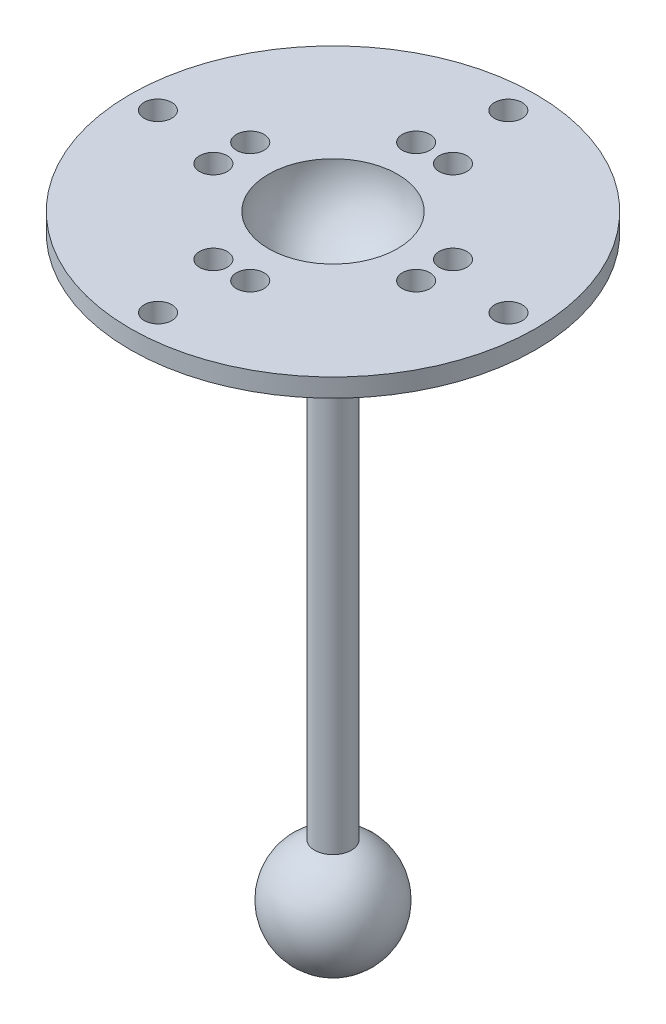
from build123d import *

# Parameters (mm, degrees)
SKETCH2_R          = 0.75
SKETCH2_R_2        = 0.5
CUT_EXTRUDE1_DEPTH = 40


with BuildPart() as part:
    # Sketch1 → Revolve1 (revolve)
    with BuildSketch(Plane(origin=(0, 0, 0), x_dir=(0, 0, -1), z_dir=(1, 0, 0))):
        with BuildLine():
            ThreePointArc((-3.5, 4), (-2.474873734, 1.525126266), (0, 0.5))
            Line((0, 0.5), (0, 0))
            Line((0, 0), (0, -25.34))
            Line((0, -25.34), (0, -31.34))
            ThreePointArc((0, -31.34), (-2.956795679, -28.847305936), (-1, -25.511572875))
            Line((-1, -25.511572875), (-1, 0.127016654))
            ThreePointArc((-1, 0.127016654), (-2.457034335, 0.843580783), (-3.50920881, 2.080246493))
            Line((-3.50920881, 2.080246493), (-11, 3))
            Line((-11, 3), (-11, 4))
            Line((-11, 4), (-4, 4))
            Line((-4, 4), (-3.5, 4))
        make_face()
    revolve(axis=Axis((0, 10.634252877, 0), (0, 1, 0)))

    # Sketch2 → Cut-Extrude1 (cut)
    with BuildSketch(Plane(origin=(0, 4, 0), x_dir=(1, 0, 0), z_dir=(0, 1, 0))):
        with Locations(Location((-5.489872585, -1, 0), (0, 0, 270))):
            Circle(SKETCH2_R)
        with Locations(Location((-9.5, 0, 0), (0, 0, 270))):
            Circle(SKETCH2_R)
        with Locations(Location((0.00965171, -9.5, 0), (0, 0, 270))):
            Circle(SKETCH2_R)
        with Locations(Location((-0.990356221, -5.500003966, 0), (0, 0, 270))):
            Circle(SKETCH2_R)
        with Locations(Location((1.009643779, -5.5, 0), (0, 0, 270))):
            Circle(SKETCH2_R)
        with Locations(Location((5.509142299, -0.999978192, 0), (0, 0, 270))):
            Circle(SKETCH2_R)
        with Locations(Location((5.509134368, 1.000021808, 0), (0, 0, 270))):
            Circle(SKETCH2_R)
        with Locations(Location((9.519265749, 3.7711e-05, 0), (0, 0, 270))):
            Circle(SKETCH2_R)
        with Locations(Location((1.009643779, 5.5, 0), (0, 0, 270))):
            Circle(SKETCH2_R)
        with Locations(Location((-0.990356221, 5.500003966, 0), (0, 0, 270))):
            Circle(SKETCH2_R)
        with Locations(Location((0.00965171, 9.5, 0), (0, 0, 270))):
            Circle(SKETCH2_R)
        with Locations(Location((0, 0, 0), (0, 0, 270))):
            Circle(SKETCH2_R_2)
        with Locations(Location((-5.489872585, 1, 0), (0, 0, 270))):
            Circle(SKETCH2_R)
    extrude(amount=-CUT_EXTRUDE1_DEPTH, mode=Mode.SUBTRACT)


solid = part.part
